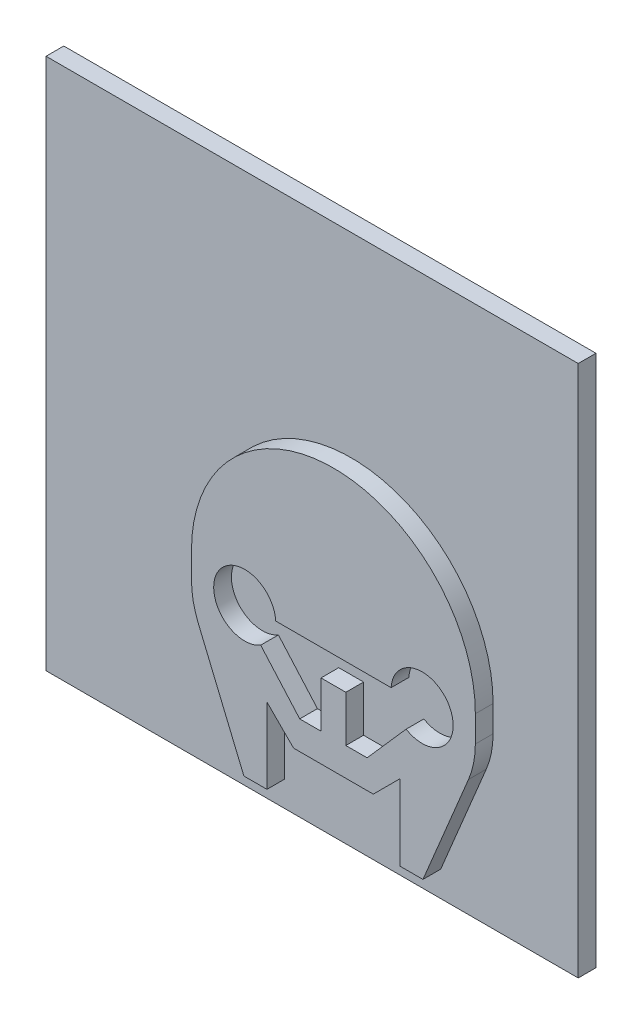
from build123d import *

# Parameters (mm, degrees)
SKICA1_W                = 300
SKICA1_H                = 300
P_IDAT_VYSUNUT_M1_DEPTH = 10
P_IDAT_VYSUNUT_M3_DEPTH = 10


with BuildPart() as part:
    # Skica1 → Přidat vysunutím1 (new body)
    with BuildSketch(Plane.XY):
        with Locations((150, 150)):
            Rectangle(SKICA1_W, SKICA1_H)
    extrude(amount=P_IDAT_VYSUNUT_M1_DEPTH)

    # Skica3 → Přidat vysunutím3 (add)
    with BuildSketch(Plane.XY.offset(10)):
        with BuildLine():
            Line((121.527137935, 14.364823185), (134.527137935, 14.364823185))
            Line((134.527137935, 14.364823185), (134.527137935, 57))
            Line((134.527137935, 57), (149.527137935, 42))
            Line((149.527137935, 42), (194.472862065, 42))
            Line((194.472862065, 42), (209.472862065, 57))
            Line((209.472862065, 57), (209.472862065, 14.364823185))
            Line((209.472862065, 14.364823185), (222.472862065, 14.364823185))
            Line((222.472862065, 14.364823185), (248.153836395, 75.999073478))
            ThreePointArc((248.153836395, 75.999073478), (251.029031296, 85.424046933), (252, 95.22986613))
            Line((252, 95.22986613), (252, 110))
            ThreePointArc((252, 110), (172, 190), (92, 110))
            Line((92, 110), (92, 95.22986613))
            ThreePointArc((92, 95.22986613), (92.970968704, 85.424046933), (95.846163605, 75.999073478))
            Line((95.846163605, 75.999073478), (121.527137935, 14.364823185))
        make_face()
        with BuildLine():
            ThreePointArc((131, 82.99166898), (106.532275896, 106.185322904), (139.47140521, 99))
            Line((139.47140521, 99), (204.52859479, 99))
            ThreePointArc((204.52859479, 99), (222.500204374, 115.492849842), (239.5, 98))
            ThreePointArc((239.5, 98), (230.624094155, 82.772557667), (213, 82.99166898))
            Line((213, 82.99166898), (191, 58))
            Line((191, 58), (179, 58))
            Line((179, 58), (179, 84))
            Line((179, 84), (165, 84))
            Line((165, 84), (165, 58))
            Line((165, 58), (153, 58))
            Line((153, 58), (131, 82.99166898))
        make_face(mode=Mode.SUBTRACT)
    extrude(amount=P_IDAT_VYSUNUT_M3_DEPTH)


solid = part.part
